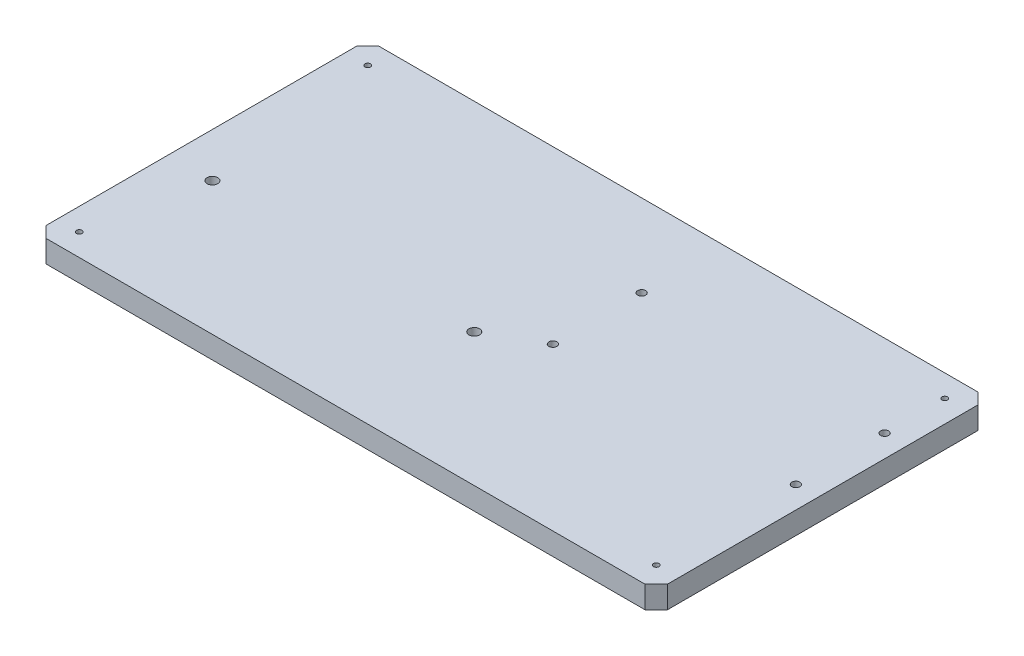
from build123d import *

# Parameters (mm, degrees)
BOSS_EXTRUDE1_DEPTH                      = 10
CBORE_FOR_M4_PAN_HEAD_SCREW1_D           = 4.8
CBORE_FOR_M4_PAN_HEAD_SCREW1_CBORE_D     = 9
CBORE_FOR_M4_PAN_HEAD_SCREW1_CBORE_DEPTH = 5
M3X0_5_TAPPED_HOLE1_D                    = 2.5
CBORE_FOR_M3_PAN_HEAD_SCREW1_D           = 3.6
CBORE_FOR_M3_PAN_HEAD_SCREW1_CBORE_D     = 7
CBORE_FOR_M3_PAN_HEAD_SCREW1_CBORE_DEPTH = 5


with BuildPart() as part:
    # Sketch1 → Boss-Extrude1 (new body)
    with BuildSketch(Plane(origin=(0, 0, 0), x_dir=(1, 0, 0), z_dir=(0, 1, 0))):
        Polygon((0, 145), (5, 150), (275, 150), (280, 145), (280, 5), (275, 0), (5, 0), (0, 5), align=None)
    extrude(amount=-BOSS_EXTRUDE1_DEPTH)

    # CBORE for M4 Pan Head Screw1 (through all)
    with Locations(Plane(origin=(0, -10, 0), x_dir=(-1, 0, 0), z_dir=(0, -1, 0))):
        with Locations((-138, 60), (-20, 60)):
            CounterBoreHole(CBORE_FOR_M4_PAN_HEAD_SCREW1_D / 2, CBORE_FOR_M4_PAN_HEAD_SCREW1_CBORE_D / 2, CBORE_FOR_M4_PAN_HEAD_SCREW1_CBORE_DEPTH)

    # M3x0.5 Tapped Hole1 (through all)
    with Locations(Plane(origin=(0, -10, 0), x_dir=(-1, 0, 0), z_dir=(0, -1, 0))):
        with Locations((-10, 10), (-10, 140), (-270, 140), (-270, 10)):
            Hole(M3X0_5_TAPPED_HOLE1_D / 2)

    # CBORE for M3 Pan Head Screw1 (through all)
    with Locations(Plane(origin=(0, -10, 0), x_dir=(-1, 0, 0), z_dir=(0, -1, 0))):
        with Locations((-160.5, 112.922675535), (-160.5, 72.922675535), (-270, 112.922675535), (-270, 72.922675535)):
            CounterBoreHole(CBORE_FOR_M3_PAN_HEAD_SCREW1_D / 2, CBORE_FOR_M3_PAN_HEAD_SCREW1_CBORE_D / 2, CBORE_FOR_M3_PAN_HEAD_SCREW1_CBORE_DEPTH)


solid = part.part
